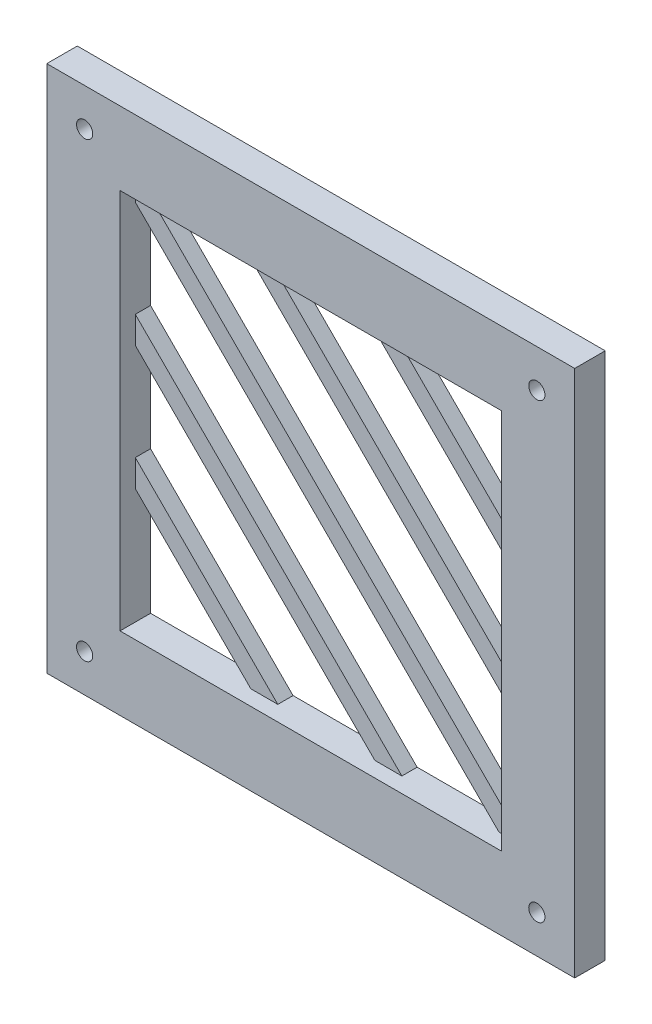
from build123d import *

# Parameters (mm, degrees)
SKETCH1_W                        = 138.42
SKETCH1_H                        = 138.42
SKETCH1_R                        = 2.125
BOSS_EXTRUDE1_DEPTH              = 8
SKETCH2_W                        = 100
SKETCH2_H                        = 100
CUT_EXTRUDE10_DEPTH              = 99.204114985
BOSS_EXTRUDE12_REACH             = 100.204
SKETCH12_W                       = 5
SKETCH12_H                       = 8
BOSS_EXTRUDE12_DIRECTION_2_REACH = 100.204
LPATTERN2_COUNT                  = 6
LPATTERN2_PITCH                  = 23
SKETCH2_3_W                      = 100
SKETCH2_3_H                      = 100
CUT_EXTRUDE13_DEPTH              = 4


with BuildPart() as part:
    # Sketch1 → Boss-Extrude1 (new body)
    with BuildSketch(Plane.XY):
        Rectangle(SKETCH1_W, SKETCH1_H)
        with Locations((-59.285, 59.285)):
            Circle(SKETCH1_R, mode=Mode.SUBTRACT)
        with Locations(Location((59.285, -59.285, 0), (0, 0, 180))):
            Circle(SKETCH1_R, mode=Mode.SUBTRACT)
        with Locations((59.285, 59.285)):
            Circle(SKETCH1_R, mode=Mode.SUBTRACT)
        with Locations(Location((-59.285, -59.285, 0), (0, 0, 180))):
            Circle(SKETCH1_R, mode=Mode.SUBTRACT)
    extrude(amount=BOSS_EXTRUDE1_DEPTH)

    # Sketch2 → Cut-Extrude10 (cut, through all)
    with BuildSketch(Plane.XY.offset(8)):
        Rectangle(SKETCH2_W, SKETCH2_H)
    extrude(amount=-CUT_EXTRUDE10_DEPTH, mode=Mode.SUBTRACT)

    # Sketch12 → Boss-Extrude12 (add, up to next)
    with BuildSketch(Plane(origin=(0, 0, 0), x_dir=(-0.7071067811865477, -0.7071067811865475, 0), z_dir=(0.7071067811865475, -0.7071067811865477, 0)), mode=Mode.PRIVATE) as boss_extrude12_sk1:
        with Locations((-68.210678119, -4)):
            Rectangle(SKETCH12_W, SKETCH12_H)
    boss_extrude12_tool1 = extrude(boss_extrude12_sk1.sketch, amount=BOSS_EXTRUDE12_REACH, mode=Mode.PRIVATE) - part.part
    boss_extrude12 = boss_extrude12_tool1.solids().sort_by_distance((48.232233, 48.232233, 4))[0]
    add(boss_extrude12)

    # Sketch12 → Boss-Extrude12 direction 2 (add, up to next)
    with BuildSketch(Plane(origin=(0, 0, 0), x_dir=(-0.7071067811865477, -0.7071067811865475, 0), z_dir=(0.7071067811865475, -0.7071067811865477, 0)), mode=Mode.PRIVATE) as boss_extrude12_direction_2_sk1:
        with Locations((-68.210678119, -4)):
            Rectangle(SKETCH12_W, SKETCH12_H)
    boss_extrude12_direction_2_tool1 = extrude(boss_extrude12_direction_2_sk1.sketch, amount=-BOSS_EXTRUDE12_DIRECTION_2_REACH, mode=Mode.PRIVATE) - part.part
    boss_extrude12_direction_2 = boss_extrude12_direction_2_tool1.solids().sort_by_distance((48.232233, 48.232233, 4))[0]
    add(boss_extrude12_direction_2)

    # LPattern2: Boss-Extrude12, Boss-Extrude12 direction 2; each copy of Boss-Extrude12, Boss-Extrude12 direction 2 runs up to whatever stops it at its own place
    lpattern2_before = part.part  # the part as the pattern finds it: every copy runs up to it
    lpattern2_boss_extrude12_long = extrude(boss_extrude12_sk1.sketch, amount=BOSS_EXTRUDE12_REACH, mode=Mode.PRIVATE)
    lpattern2_boss_extrude12_tool1 = lpattern2_boss_extrude12_long.moved(Location(Vector(-0.7071067811865477, -0.7071067811865475, 0) * (1 * LPATTERN2_PITCH))) - lpattern2_before
    add(lpattern2_boss_extrude12_tool1.solids().sort_by_distance((31.968777, 31.968777, 4))[0])
    lpattern2_boss_extrude12_tool2 = lpattern2_boss_extrude12_long.moved(Location(Vector(-0.7071067811865477, -0.7071067811865475, 0) * (2 * LPATTERN2_PITCH))) - lpattern2_before
    add(lpattern2_boss_extrude12_tool2.solids().sort_by_distance((15.705321, 15.705321, 4))[0])
    lpattern2_boss_extrude12_tool3 = lpattern2_boss_extrude12_long.moved(Location(Vector(-0.7071067811865477, -0.7071067811865475, 0) * (3 * LPATTERN2_PITCH))) - lpattern2_before
    add(lpattern2_boss_extrude12_tool3.solids().sort_by_distance((-0.558135, -0.558135, 4))[0])
    lpattern2_boss_extrude12_tool4 = lpattern2_boss_extrude12_long.moved(Location(Vector(-0.7071067811865477, -0.7071067811865475, 0) * (4 * LPATTERN2_PITCH))) - lpattern2_before
    add(lpattern2_boss_extrude12_tool4.solids().sort_by_distance((-16.821591, -16.821591, 4))[0])
    lpattern2_boss_extrude12_tool5 = lpattern2_boss_extrude12_long.moved(Location(Vector(-0.7071067811865477, -0.7071067811865475, 0) * (5 * LPATTERN2_PITCH))) - lpattern2_before
    add(lpattern2_boss_extrude12_tool5.solids().sort_by_distance((-33.085047, -33.085047, 4))[0])
    lpattern2_boss_extrude12_direction_2_long = extrude(boss_extrude12_direction_2_sk1.sketch, amount=-BOSS_EXTRUDE12_DIRECTION_2_REACH, mode=Mode.PRIVATE)
    lpattern2_boss_extrude12_direction_2_tool1 = lpattern2_boss_extrude12_direction_2_long.moved(Location(Vector(-0.7071067811865477, -0.7071067811865475, 0) * (1 * LPATTERN2_PITCH))) - lpattern2_before
    add(lpattern2_boss_extrude12_direction_2_tool1.solids().sort_by_distance((31.968777, 31.968777, 4))[0])
    lpattern2_boss_extrude12_direction_2_tool2 = lpattern2_boss_extrude12_direction_2_long.moved(Location(Vector(-0.7071067811865477, -0.7071067811865475, 0) * (2 * LPATTERN2_PITCH))) - lpattern2_before
    add(lpattern2_boss_extrude12_direction_2_tool2.solids().sort_by_distance((15.705321, 15.705321, 4))[0])
    lpattern2_boss_extrude12_direction_2_tool3 = lpattern2_boss_extrude12_direction_2_long.moved(Location(Vector(-0.7071067811865477, -0.7071067811865475, 0) * (3 * LPATTERN2_PITCH))) - lpattern2_before
    add(lpattern2_boss_extrude12_direction_2_tool3.solids().sort_by_distance((-0.558135, -0.558135, 4))[0])
    lpattern2_boss_extrude12_direction_2_tool4 = lpattern2_boss_extrude12_direction_2_long.moved(Location(Vector(-0.7071067811865477, -0.7071067811865475, 0) * (4 * LPATTERN2_PITCH))) - lpattern2_before
    add(lpattern2_boss_extrude12_direction_2_tool4.solids().sort_by_distance((-16.821591, -16.821591, 4))[0])
    lpattern2_boss_extrude12_direction_2_tool5 = lpattern2_boss_extrude12_direction_2_long.moved(Location(Vector(-0.7071067811865477, -0.7071067811865475, 0) * (5 * LPATTERN2_PITCH))) - lpattern2_before
    add(lpattern2_boss_extrude12_direction_2_tool5.solids().sort_by_distance((-33.085047, -33.085047, 4))[0])

    # Sketch2<3> → Cut-Extrude13 (cut)
    with BuildSketch(Plane.XY.offset(8)):
        Rectangle(SKETCH2_3_W, SKETCH2_3_H)
    extrude(amount=-CUT_EXTRUDE13_DEPTH, mode=Mode.SUBTRACT)


solid = part.part
